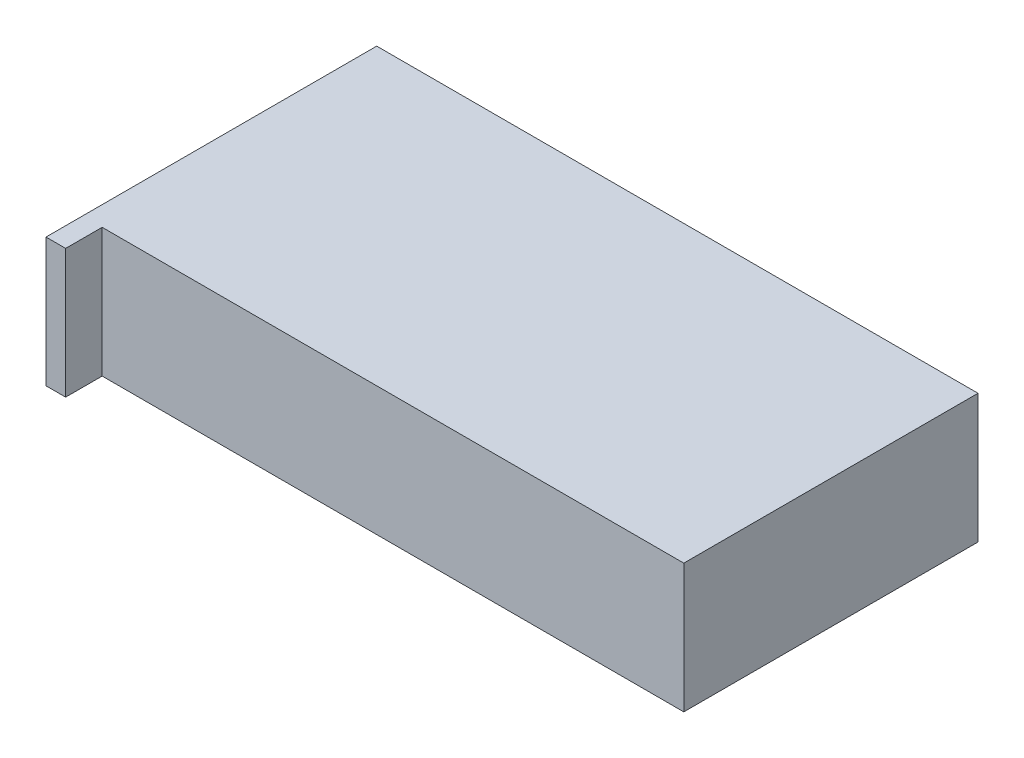
from build123d import *

# Parameters (mm, degrees)
SKETCH1_W           = 71.12
SKETCH1_H           = 34.798
BOSS_EXTRUDE1_DEPTH = 15.24
SKETCH2_W           = 2.324339834
SKETCH2_H           = 15.24
BOSS_EXTRUDE2_DEPTH = 4.318


with BuildPart() as part:
    # Sketch1 → Boss-Extrude1 (new body)
    with BuildSketch(Plane(origin=(0, 0, 0), x_dir=(1, 0, 0), z_dir=(0, 1, 0))):
        with Locations((35.56, 17.399)):
            Rectangle(SKETCH1_W, SKETCH1_H)
    extrude(amount=BOSS_EXTRUDE1_DEPTH)

    # Sketch2 → Boss-Extrude2 (add)
    with BuildSketch(Plane.XY):
        with Locations((1.162169917, 7.62)):
            Rectangle(SKETCH2_W, SKETCH2_H)
    extrude(amount=BOSS_EXTRUDE2_DEPTH)


solid = part.part
